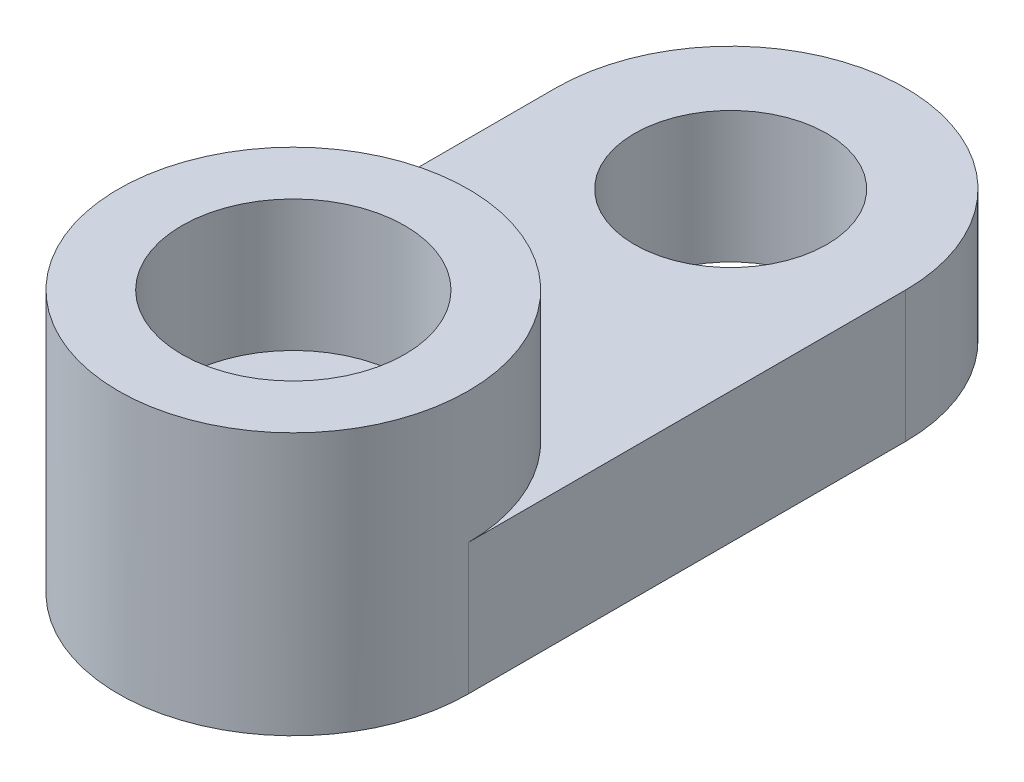
from build123d import *

# Parameters (mm, degrees)
SKETCH1_R           = 1.778
SKETCH1_R_2         = 2.794
BASE_DEPTH          = 3.81
SKETCH2_R           = 5.08
SKETCH2_R_2         = 3.2385
BOSS_EXTRUDE2_DEPTH = 3.81


with BuildPart() as part:
    # Sketch1 → base (new body)
    with BuildSketch(Plane(origin=(0, 0, 0), x_dir=(1, 0, 0), z_dir=(0, 1, 0))):
        with BuildLine():
            Line((-5.08, 0), (-5.08, 12.7))
            ThreePointArc((-5.08, 12.7), (0, 17.78), (5.08, 12.7))
            Line((5.08, 12.7), (5.08, 0))
            ThreePointArc((5.08, 0), (0, -5.08), (-5.08, 0))
        make_face()
        with Locations(Location((0, 0, 0), (0, 0, 90))):
            Circle(SKETCH1_R, mode=Mode.SUBTRACT)
        with Locations(Location((0, 12.7, 0), (0, 0, 90))):
            Circle(SKETCH1_R_2, mode=Mode.SUBTRACT)
    extrude(amount=BASE_DEPTH)

    # Sketch2 → Boss-Extrude2 (add)
    with BuildSketch(Plane(origin=(0, 3.81, 0), x_dir=(1, 0, 0), z_dir=(0, 1, 0))):
        Circle(SKETCH2_R)
        with Locations(Location((0, 0, 0), (0, 0, 90))):
            Circle(SKETCH2_R_2, mode=Mode.SUBTRACT)
    extrude(amount=BOSS_EXTRUDE2_DEPTH)


solid = part.part
